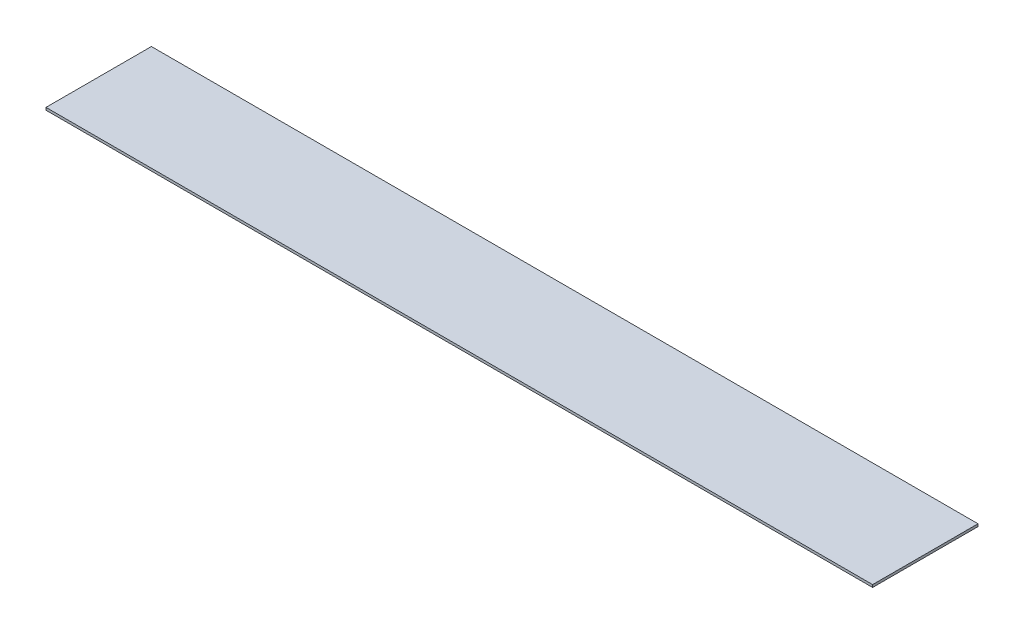
from build123d import *

# Parameters (mm, degrees)
SKETCH1_W           = 165.1
SKETCH1_H           = 21.05
BOSS_EXTRUDE1_DEPTH = 0.25


with BuildPart() as part:
    # Sketch1 → Boss-Extrude1 (new, symmetric)
    with BuildSketch(Plane(origin=(0, 0, 0), x_dir=(1, 0, 0), z_dir=(0, 1, 0))):
        Rectangle(SKETCH1_W, SKETCH1_H)
    extrude(amount=BOSS_EXTRUDE1_DEPTH, both=True)


solid = part.part
